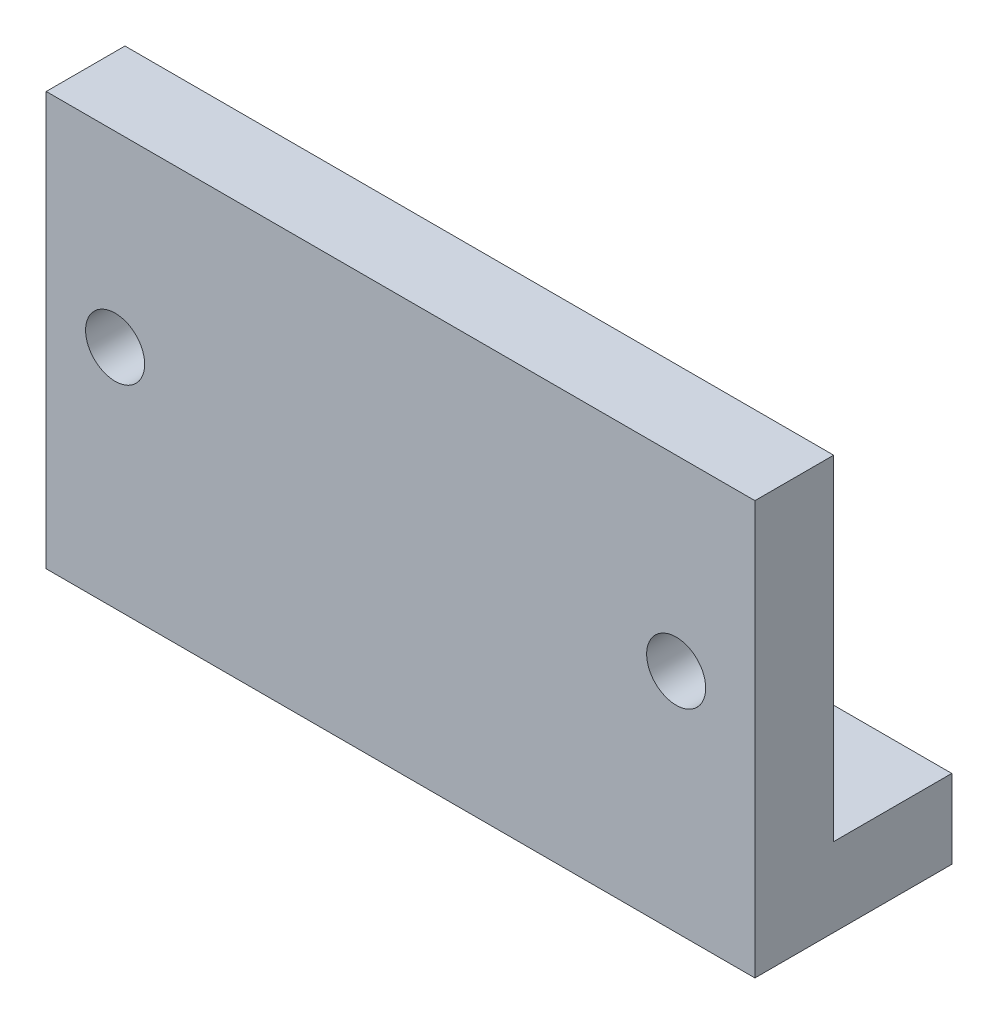
from build123d import *

# Parameters (mm, degrees)
CROQUIS1_W              = 36
CROQUIS1_H              = 10
SALIENTE_EXTRUIR1_DEPTH = 7
CROQUIS3_W              = 36
CROQUIS3_H              = 4
SALIENTE_EXTRUIR2_DEPTH = 14
CROQUIS4_R              = 1.5
CORTAR_EXTRUIR1_DEPTH   = 10
CROQUIS5_R              = 1.5
CORTAR_EXTRUIR2_DEPTH   = 10
CROQUIS6_W              = 36
CROQUIS6_H              = 3
CORTAR_EXTRUIR3_DEPTH   = 6


with BuildPart() as part:
    # Croquis1 → Saliente-Extruir1 (new body)
    with BuildSketch(Plane(origin=(0, 0, 0), x_dir=(1, 0, 0), z_dir=(0, 1, 0))):
        with Locations((-18, -5)):
            Rectangle(CROQUIS1_W, CROQUIS1_H)
    extrude(amount=SALIENTE_EXTRUIR1_DEPTH)

    # Croquis3 → Saliente-Extruir2 (add)
    with BuildSketch(Plane(origin=(0, 7, 0), x_dir=(1, 0, 0), z_dir=(0, 1, 0))):
        with Locations((-18, -8)):
            Rectangle(CROQUIS3_W, CROQUIS3_H)
    extrude(amount=SALIENTE_EXTRUIR2_DEPTH)

    # Croquis4 → Cortar-Extruir1 (cut)
    with BuildSketch(Plane(origin=(0, 7, 0), x_dir=(1, 0, 0), z_dir=(0, 1, 0))):
        with Locations(Location((-30, -3, 0), (0, 0, 270))):
            Circle(CROQUIS4_R)
        with Locations(Location((-18, -3, 0), (0, 0, 270))):
            Circle(CROQUIS4_R)
        with Locations(Location((-6, -3, 0), (0, 0, 270))):
            Circle(CROQUIS4_R)
    extrude(amount=-CORTAR_EXTRUIR1_DEPTH, mode=Mode.SUBTRACT)

    # Croquis5 → Cortar-Extruir2 (cut)
    with BuildSketch(Plane.XY.offset(10)):
        with Locations((-32.5, 11.5)):
            Circle(CROQUIS5_R)
        with Locations((-4, 11.5)):
            Circle(CROQUIS5_R)
    extrude(amount=-CORTAR_EXTRUIR2_DEPTH, mode=Mode.SUBTRACT)

    # Croquis6 → Cortar-Extruir3 (cut)
    with BuildSketch(Plane(origin=(0, 0, 0), x_dir=(-1, 0, 0), z_dir=(0, 0, -1))):
        with Locations((18, 5.5)):
            Rectangle(CROQUIS6_W, CROQUIS6_H)
    extrude(amount=-CORTAR_EXTRUIR3_DEPTH, mode=Mode.SUBTRACT)


solid = part.part
